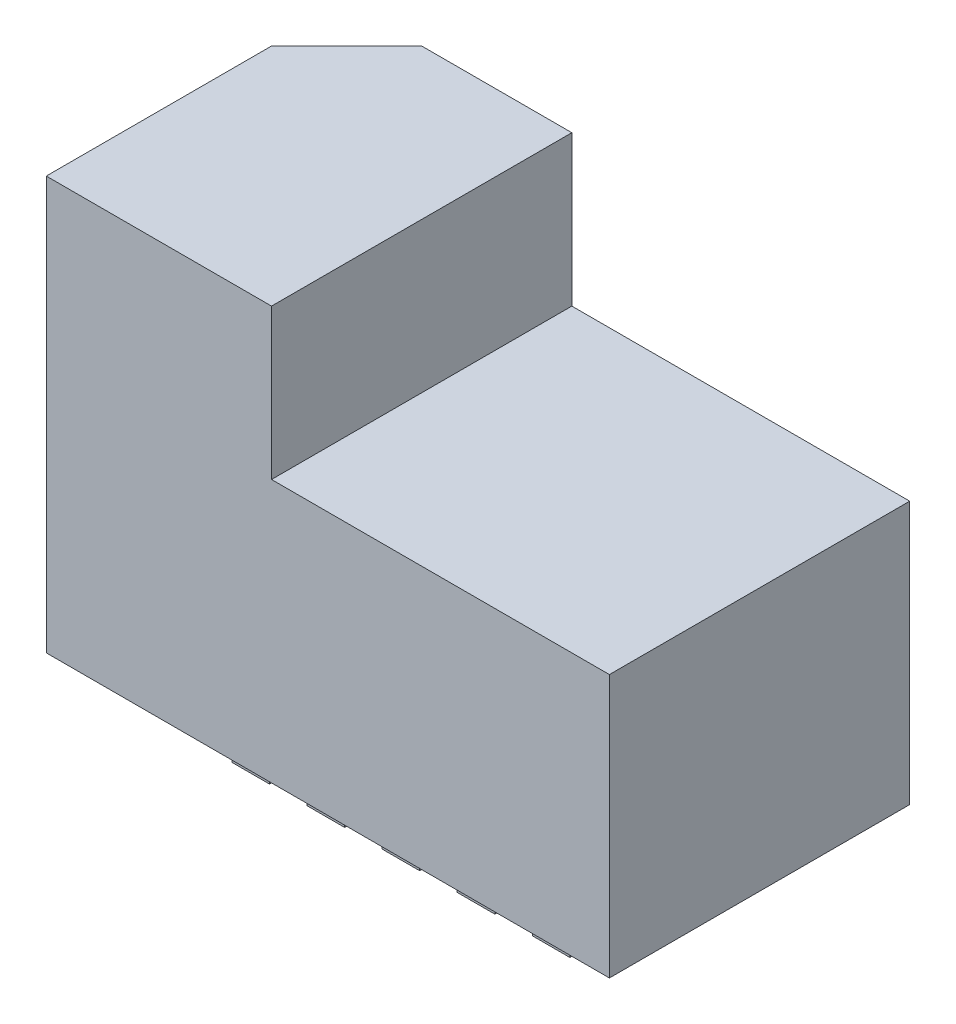
from build123d import *

# Parameters (mm, degrees)
BOSS_EXTRUDE1_DEPTH = 69.85
SKETCH2_W           = 50.8
SKETCH2_H           = 44.45
BOSS_EXTRUDE2_DEPTH = 57.15
SKETCH3_W           = 6.35
SKETCH3_H           = 38.023239414
BOSS_EXTRUDE3_DEPTH = 6.35


with BuildPart() as part:
    # Sketch1 → Boss-Extrude1 (new body)
    with BuildSketch(Plane(origin=(0, 0, 0), x_dir=(1, 0, 0), z_dir=(0, 1, 0))):
        Polygon((0, 0), (38.1, 0), (38.1, 50.8), (12.7, 50.8), (0, 38.1), align=None)
    extrude(amount=BOSS_EXTRUDE1_DEPTH)

    # Sketch2 → Boss-Extrude2 (add)
    with BuildSketch(Plane(origin=(38.1, 0, 0), x_dir=(0, 0, -1), z_dir=(1, 0, 0))):
        with Locations((25.4, 22.225)):
            Rectangle(SKETCH2_W, SKETCH2_H)
    extrude(amount=BOSS_EXTRUDE2_DEPTH)

    # Sketch3 → Boss-Extrude3 (add)
    with BuildSketch(Plane(origin=(0, 0, 0), x_dir=(-1, 0, 0), z_dir=(0, -1, 0))):
        with Locations((-28.575, 25.024461833)):
            Rectangle(SKETCH3_W, SKETCH3_H)
        with Locations((-41.275, 25.024461833)):
            Rectangle(SKETCH3_W, SKETCH3_H)
        with Locations((-53.975, 25.024461833)):
            Rectangle(SKETCH3_W, SKETCH3_H)
        with Locations((-66.675, 25.024461833)):
            Rectangle(SKETCH3_W, SKETCH3_H)
        with Locations((-79.375, 25.024461833)):
            Rectangle(SKETCH3_W, SKETCH3_H)
    extrude(amount=BOSS_EXTRUDE3_DEPTH)


solid = part.part
